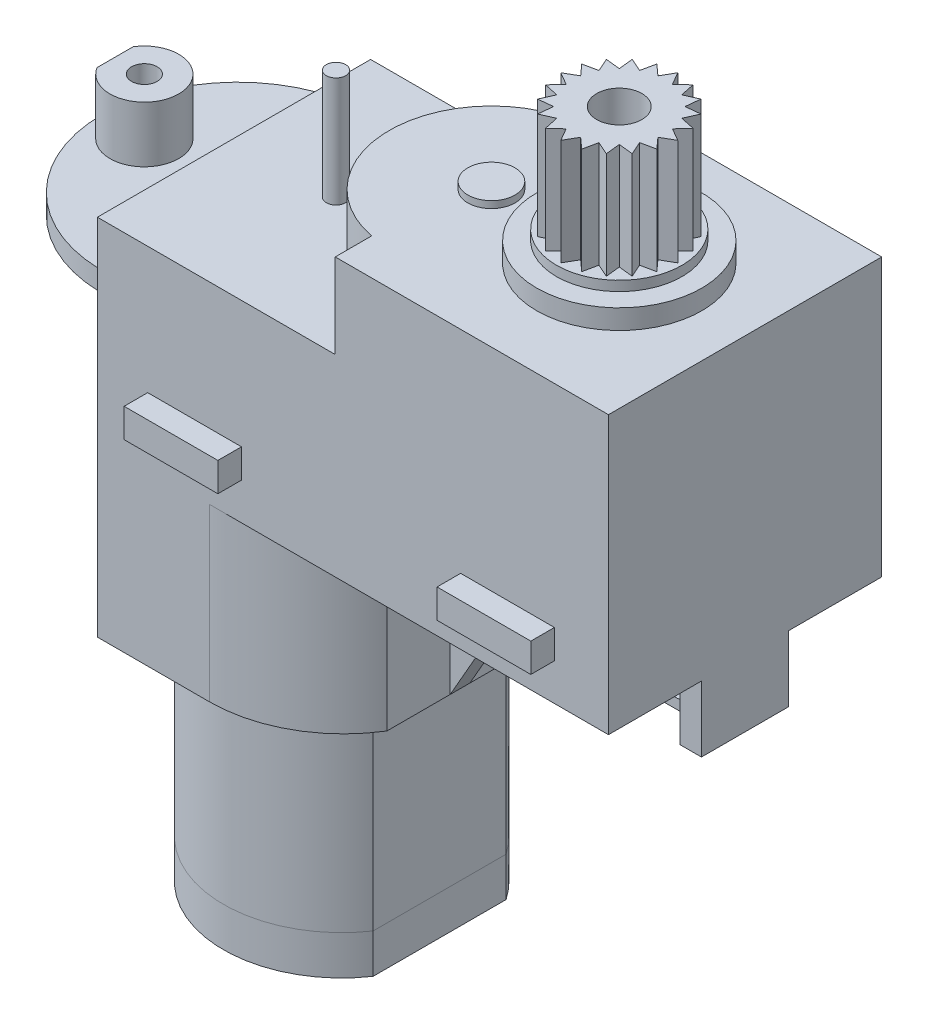
from build123d import *

# Parameters (mm, degrees)
SKETCH1_W            = 26
SKETCH1_H            = 13.9
BOSS_EXTRUDE1_DEPTH  = 9.8
BOSS_EXTRUDE2_DEPTH  = 4.3
SKETCH4_R            = 4.2
BOSS_EXTRUDE3_DEPTH  = 1
SKETCH5_R            = 3.19
BOSS_EXTRUDE4_DEPTH  = 0.5
SKETCH6_R            = 1.15
BOSS_EXTRUDE5_DEPTH  = 5.4
SKETCH7_R            = 0.49
BOSS_EXTRUDE6_DEPTH  = 5.6
BOSS_EXTRUDE7_DEPTH  = 8.7
BOSS_EXTRUDE8_DEPTH  = 11.5
BOSS_EXTRUDE9_DEPTH  = 3.35
CUT_EXTRUDE1_DEPTH   = 35.297084424
BOSS_EXTRUDE10_START = -2.3
BOSS_EXTRUDE10_DEPTH = 1
BOSS_EXTRUDE11_DEPTH = 2.85
SKETCH15_R           = 0.65
CUT_EXTRUDE2_DEPTH   = 41.713695484
SKETCH14_R           = 1.665
SKETCH14_R_2         = 0.65
BOSS_EXTRUDE12_DEPTH = 1.8
BOSS_EXTRUDE13_DEPTH = 0.68
BOSS_EXTRUDE14_DEPTH = 0.5
SKETCH18_R           = 1.2
BOSS_EXTRUDE15_DEPTH = 0.35
SKETCH20_W           = 4.77
SKETCH20_H           = 1.47
BOSS_EXTRUDE16_DEPTH = 8.15
SKETCH21_R           = 1.4
BOSS_EXTRUDE17_DEPTH = 1
BOSS_EXTRUDE18_START = -1
SKETCH22_R           = 1.4
BOSS_EXTRUDE18_DEPTH = 1.5


with BuildPart() as part:
    # Sketch1 → Boss-Extrude1 (new body)
    with BuildSketch(Plane(origin=(0, 0, 0), x_dir=(1, 0, 0), z_dir=(0, 1, 0))):
        with Locations((13, 0)):
            Rectangle(SKETCH1_W, SKETCH1_H)
    extrude(amount=BOSS_EXTRUDE1_DEPTH)

    # Sketch2 → Boss-Extrude2 (add)
    with BuildSketch(Plane(origin=(0, 9.8, 0), x_dir=(1, 0, 0), z_dir=(0, 1, 0))):
        with BuildLine():
            Line((26, -6.95), (26, 6.95))
            Line((26, 6.95), (12.1, 6.95))
            Line((12.1, 6.95), (12.1, 5.1))
            ThreePointArc((12.1, 5.1), (7.9, 0), (12.1, -5.1))
            Line((12.1, -5.1), (12.1, -6.95))
            Line((12.1, -6.95), (26, -6.95))
        make_face()
    extrude(amount=BOSS_EXTRUDE2_DEPTH)

    # Sketch4 → Boss-Extrude3 (add)
    with BuildSketch(Plane(origin=(0, 14.1, 0), x_dir=(1, 0, 0), z_dir=(0, 1, 0))):
        with Locations(Location((19.6, 0, 0), (0, 0, 270))):
            Circle(SKETCH4_R)
    extrude(amount=BOSS_EXTRUDE3_DEPTH)

    # Sketch5 → Boss-Extrude4 (add)
    with BuildSketch(Plane(origin=(0, 15.1, 0), x_dir=(1, 0, 0), z_dir=(0, 1, 0))):
        with Locations(Location((19.6, 0, 0), (0, 0, 270))):
            Circle(SKETCH5_R)
    extrude(amount=BOSS_EXTRUDE4_DEPTH)

    # Sketch6 → Boss-Extrude5 (add)
    with BuildSketch(Plane(origin=(0, 15.6, 0), x_dir=(1, 0, 0), z_dir=(0, 1, 0))):
        Polygon((18.680674442, 2.829393136), (19.230241972, 2.334560309), (19.6, 2.975), (19.969758028, 2.334560309), (20.519325558, 2.829393136), (20.673079592, 2.10603728), (21.348661126, 2.406825558), (21.271360649, 1.671360649), (22.006825558, 1.748661126), (21.70603728, 1.073079592), (22.429393136, 0.919325558), (21.934560309, 0.369758028), (22.575, 0), (21.934560309, -0.369758028), (22.429393136, -0.919325558), (21.70603728, -1.073079592), (22.006825558, -1.748661126), (21.271360649, -1.671360649), (21.348661126, -2.406825558), (20.673079592, -2.10603728), (20.519325558, -2.829393136), (19.969758028, -2.334560309), (19.6, -2.975), (19.230241972, -2.334560309), (18.680674442, -2.829393136), (18.526920408, -2.10603728), (17.851338874, -2.406825558), (17.928639351, -1.671360649), (17.193174442, -1.748661126), (17.49396272, -1.073079592), (16.770606864, -0.919325558), (17.265439691, -0.369758028), (16.625, 0), (17.265439691, 0.369758028), (16.770606864, 0.919325558), (17.49396272, 1.073079592), (17.193174442, 1.748661126), (17.928639351, 1.671360649), (17.851338874, 2.406825558), (18.526920408, 2.10603728), align=None)
        with Locations(Location((19.6, 0, 0), (0, 0, 90))):
            Circle(SKETCH6_R, mode=Mode.SUBTRACT)
    extrude(amount=BOSS_EXTRUDE5_DEPTH)

    # Sketch7 → Boss-Extrude6 (add)
    with BuildSketch(Plane(origin=(0, 9.8, 0), x_dir=(1, 0, 0), z_dir=(0, 1, 0))):
        with Locations(Location((5.19, 0, 0), (0, 0, 90))):
            Circle(SKETCH7_R)
    extrude(amount=BOSS_EXTRUDE6_DEPTH)

    # Sketch8 → Boss-Extrude7 (add)
    with BuildSketch(Plane.XZ):
        with BuildLine():
            Line((11.5, 3.725), (11.5, -3.725))
            ThreePointArc((11.5, -3.725), (9.018155549, -6.089531686), (5.7, -6.95))
            Line((5.7, -6.95), (0, -6.95))
            Line((0, -6.95), (0, 6.95))
            Line((0, 6.95), (5.7, 6.95))
            ThreePointArc((5.7, 6.95), (9.018155549, 6.089531686), (11.5, 3.725))
        make_face()
    extrude(amount=BOSS_EXTRUDE7_DEPTH)

    # Sketch9 → Boss-Extrude8 (add)
    with BuildSketch(Plane.XZ.offset(8.7)):
        with BuildLine():
            Line((0.5, 3.382306905), (0.5, -3.382306905))
            ThreePointArc((0.5, -3.382306905), (5.48, -6.02), (10.46, -3.382306905))
            Line((10.46, -3.382306905), (10.46, 3.382306905))
            ThreePointArc((10.46, 3.382306905), (5.48, 6.02), (0.5, 3.382306905))
        make_face()
    extrude(amount=BOSS_EXTRUDE8_DEPTH)

    # Sketch10 → Boss-Extrude9 (add)
    with BuildSketch(Plane.XZ):
        Polygon((26, 2.22), (26, -2.22), (24.91, -2.22), (24.91, -0.75), (21.49, -0.75), (21.49, -2.22), (20.4, -2.22), (20.4, 2.22), (21.49, 2.22), (21.49, 0.75), (24.91, 0.75), (24.91, 2.22), align=None)
    extrude(amount=BOSS_EXTRUDE9_DEPTH)

    # Sketch11 → Cut-Extrude1 (cut, through all)
    with BuildSketch(Plane(origin=(0, 0, -0.75), x_dir=(-1, 0, 0), z_dir=(0, 0, -1))):
        with BuildLine():
            Line((-24.2, 0), (-24.2, -1.85))
            ThreePointArc((-24.2, -1.85), (-23.2, -2.85), (-22.2, -1.85))
            Line((-22.2, -1.85), (-22.2, 0))
            Line((-22.2, 0), (-24.2, 0))
        make_face()
    extrude(amount=-CUT_EXTRUDE1_DEPTH, mode=Mode.SUBTRACT)

    # Sketch12 → Boss-Extrude10 (add)
    with BuildSketch(Plane(origin=(0, 9.8, 0), x_dir=(1, 0, 0), z_dir=(0, 1, 0)).offset(BOSS_EXTRUDE10_START)):
        with BuildLine():
            Line((0, 6.876790543), (0, -6.876790543))
            ThreePointArc((0, -6.876790543), (-6.7, 0), (0, 6.876790543))
        make_face()
    extrude(amount=-BOSS_EXTRUDE10_DEPTH)

    # Sketch13 → Boss-Extrude11 (add)
    with BuildSketch(Plane(origin=(0, 7.5, 0), x_dir=(1, 0, 0), z_dir=(0, 1, 0))):
        with BuildLine():
            Line((-6.05, 0.917823512), (-6.05, -0.917823512))
            ThreePointArc((-6.05, -0.917823512), (-2.81, 0), (-6.05, 0.917823512))
        make_face()
    extrude(amount=BOSS_EXTRUDE11_DEPTH)

    # Sketch15 → Cut-Extrude2 (cut, through all)
    with BuildSketch(Plane(origin=(0, 10.35, 0), x_dir=(1, 0, 0), z_dir=(0, 1, 0))):
        with Locations(Location((-4.56, 0, 0), (0, 0, 270))):
            Circle(SKETCH15_R)
    extrude(amount=-CUT_EXTRUDE2_DEPTH, mode=Mode.SUBTRACT)

    # Sketch14 → Boss-Extrude12 (add)
    with BuildSketch(Plane.XZ.offset(-6.5)):
        with Locations(Location((-4.56, 0, 0), (0, 0, 90))):
            Circle(SKETCH14_R)
        with Locations(Location((-4.56, 0, 0), (0, 0, 90))):
            Circle(SKETCH14_R_2, mode=Mode.SUBTRACT)
    extrude(amount=BOSS_EXTRUDE12_DEPTH)

    # Sketch16 → Boss-Extrude13 (add, symmetric)
    with BuildSketch(Plane.XY):
        with BuildLine():
            Line((-3.2, 6.5), (-3.2, 4.7))
            ThreePointArc((-3.2, 4.7), (-2.636457892, 3.039858484), (-1.178739757, 2.065842366))
            Line((-1.178739757, 2.065842366), (0, 1.75))
            Line((0, 1.75), (0, 6.5))
            Line((0, 6.5), (-0.625, 6.5))
            Line((-0.625, 6.5), (-0.625, 4.5))
            ThreePointArc((-0.625, 4.5), (-1.6, 3.525), (-2.575, 4.5))
            Line((-2.575, 4.5), (-2.575, 6.5))
            Line((-2.575, 6.5), (-3.2, 6.5))
        make_face()
    extrude(amount=BOSS_EXTRUDE13_DEPTH, both=True)

    # Sketch17 → Boss-Extrude14 (add, symmetric)
    with BuildSketch(Plane.XY):
        Polygon((11.5, -8.7), (15.9, -1), (20.4, -1), (20.4, 0), (11.5, 0), align=None)
    extrude(amount=BOSS_EXTRUDE14_DEPTH, both=True)

    # Sketch18 → Boss-Extrude15 (add)
    with BuildSketch(Plane(origin=(0, 14.1, 0), x_dir=(1, 0, 0), z_dir=(0, 1, 0))):
        with Locations(Location((13.096428571, 0, 0), (0, 0, 270))):
            Circle(SKETCH18_R)
    extrude(amount=BOSS_EXTRUDE15_DEPTH)

    # Sketch20 → Boss-Extrude16 (add, symmetric)
    with BuildSketch(Plane.XY):
        with Locations((4.945, 2.615)):
            Rectangle(SKETCH20_W, SKETCH20_H)
        with Locations((20.865, 2.615)):
            Rectangle(SKETCH20_W, SKETCH20_H)
    extrude(amount=BOSS_EXTRUDE16_DEPTH, both=True)

    # Sketch21 → Boss-Extrude17 (add)
    with BuildSketch(Plane.XZ):
        with Locations((19.7, 0)):
            Circle(SKETCH21_R)
    extrude(amount=BOSS_EXTRUDE17_DEPTH)

    # Sketch22 → Boss-Extrude18 (add)
    with BuildSketch(Plane.XZ.offset(1).offset(BOSS_EXTRUDE18_START)):
        with Locations((12, 0)):
            Circle(SKETCH22_R)
    extrude(amount=BOSS_EXTRUDE18_DEPTH)


solid = part.part
